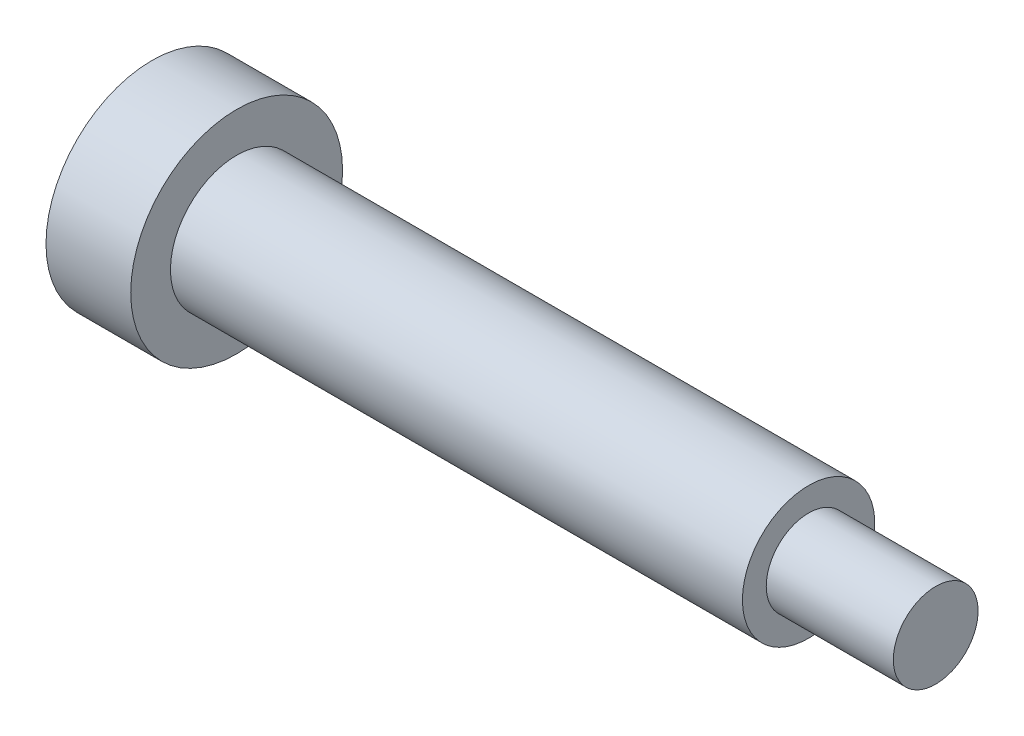
from build123d import *


with BuildPart() as part:
    # Sketch1 → Revolve1 (revolve)
    with BuildSketch(Plane.XY, mode=Mode.PRIVATE) as revolve1_sk:
        Polygon((0, 0), (0, 5), (4, 5), (4, 3.125), (31, 3.125), (31, 2), (37, 2), (37, 0), align=None)
    revolve(revolve1_sk.sketch.rotate(Axis((0, 0, 0), (1, 0, 0)), 90), axis=Axis((0, 0, 0), (1, 0, 0)))


solid = part.part
